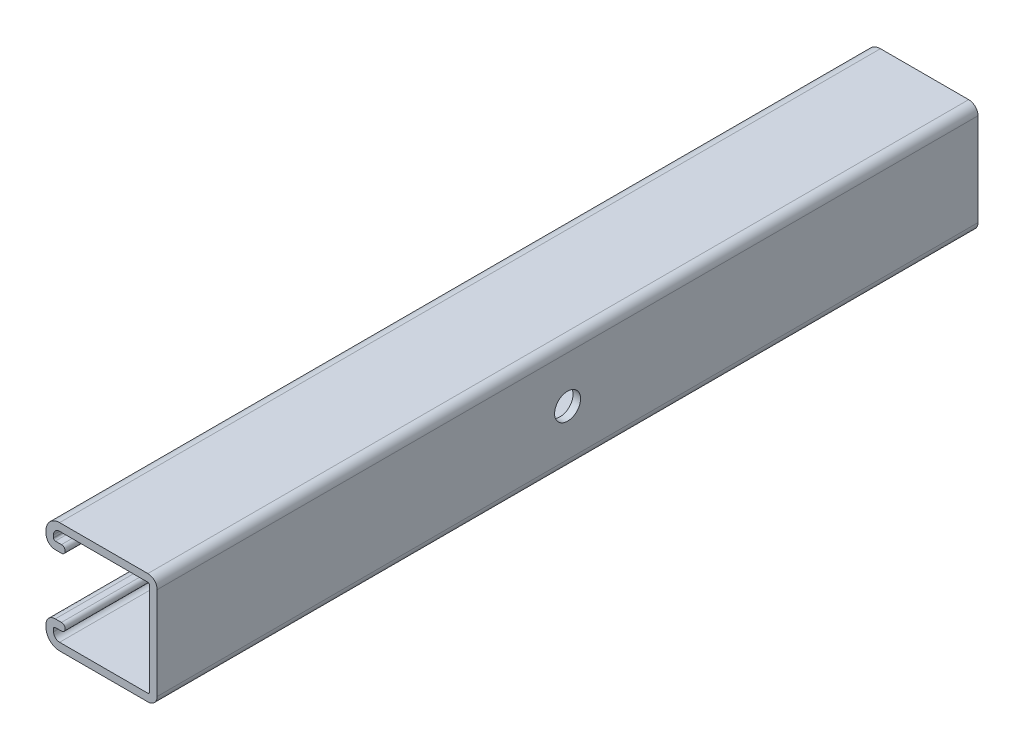
from build123d import *

# Parameters (mm, degrees)
BOSS_EXTRUDE1_DEPTH = 304.8
SKETCH4_R           = 4.826
CUT_EXTRUDE1_DEPTH  = 309.273534432


with BuildPart() as part:
    # Sketch1 → Boss-Extrude1 (new body)
    with BuildSketch(Plane.XY):
        with BuildLine():
            Line((-36.22675, 20.6375), (-3.46075, 20.6375))
            ThreePointArc((-3.46075, 20.6375), (-1.013630207, 19.623869793), (0, 17.17675))
            Line((0, 17.17675), (0, -17.17675))
            ThreePointArc((0, -17.17675), (-1.013630207, -19.623869793), (-3.46075, -20.6375))
            Line((-3.46075, -20.6375), (-36.22675, -20.6375))
            ThreePointArc((-36.22675, -20.6375), (-39.796401808, -19.158901808), (-41.275, -15.58925))
            Line((-41.275, -15.58925), (-41.275, -14.57325))
            ThreePointArc((-41.275, -14.57325), (-40.261369793, -12.126130207), (-37.81425, -11.1125))
            Line((-37.81425, -11.1125), (-35.5346, -11.1125))
            ThreePointArc((-35.5346, -11.1125), (-34.1376, -12.5095), (-35.5346, -13.9065))
            Line((-35.5346, -13.9065), (-37.81425, -13.9065))
            ThreePointArc((-37.81425, -13.9065), (-38.285713446, -14.101786554), (-38.481, -14.57325))
            Line((-38.481, -14.57325), (-38.481, -15.58925))
            ThreePointArc((-38.481, -15.58925), (-37.820745461, -17.183245461), (-36.22675, -17.8435))
            Line((-36.22675, -17.8435), (-3.46075, -17.8435))
            ThreePointArc((-3.46075, -17.8435), (-2.989286554, -17.648213446), (-2.794, -17.17675))
            Line((-2.794, -17.17675), (-2.794, 17.17675))
            ThreePointArc((-2.794, 17.17675), (-2.989286554, 17.648213446), (-3.46075, 17.8435))
            Line((-3.46075, 17.8435), (-36.22675, 17.8435))
            ThreePointArc((-36.22675, 17.8435), (-37.820745461, 17.183245461), (-38.481, 15.58925))
            Line((-38.481, 15.58925), (-38.481, 14.57325))
            ThreePointArc((-38.481, 14.57325), (-38.285713446, 14.101786554), (-37.81425, 13.9065))
            Line((-37.81425, 13.9065), (-35.5346, 13.9065))
            ThreePointArc((-35.5346, 13.9065), (-34.1376, 12.5095), (-35.5346, 11.1125))
            Line((-35.5346, 11.1125), (-37.81425, 11.1125))
            ThreePointArc((-37.81425, 11.1125), (-40.261369793, 12.126130207), (-41.275, 14.57325))
            Line((-41.275, 14.57325), (-41.275, 15.58925))
            ThreePointArc((-41.275, 15.58925), (-39.796401808, 19.158901808), (-36.22675, 20.6375))
        make_face()
    extrude(amount=-BOSS_EXTRUDE1_DEPTH)

    # Sketch4 → Cut-Extrude1 (cut, through all)
    with BuildSketch(Plane(origin=(0, 0, 0), x_dir=(0, 0, -1), z_dir=(1, 0, 0))):
        with Locations(Location((152.4, 0, 0), (0, 0, 90))):
            Circle(SKETCH4_R)
    extrude(amount=-CUT_EXTRUDE1_DEPTH, mode=Mode.SUBTRACT)


solid = part.part
